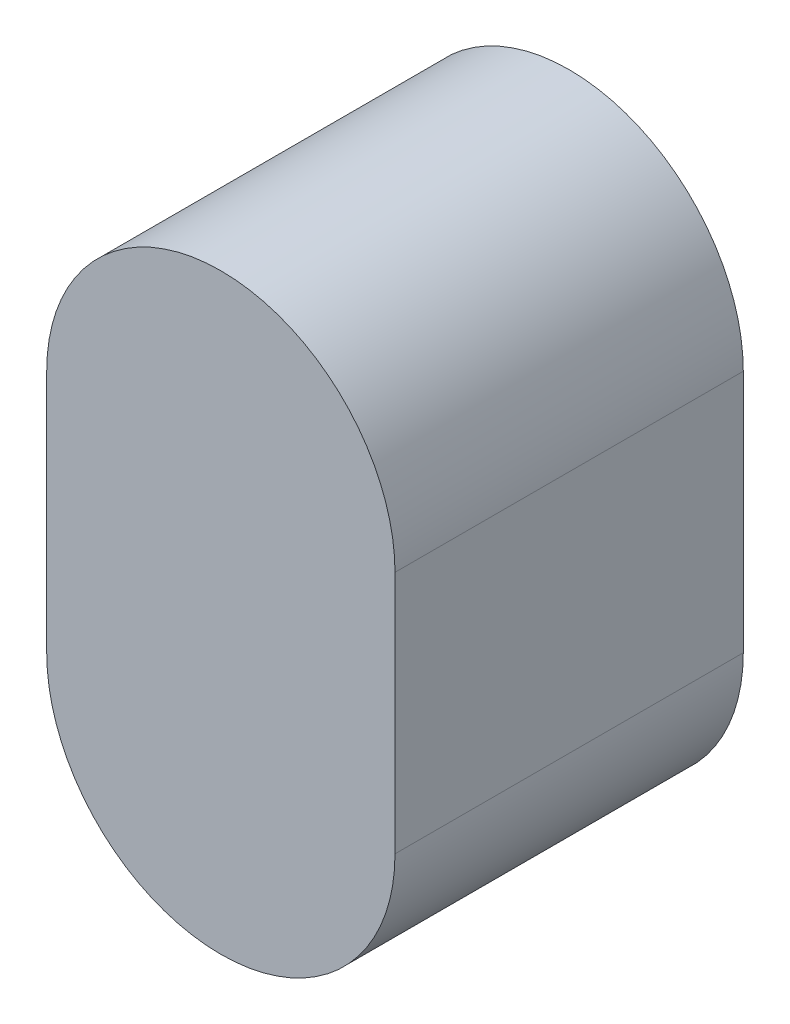
from build123d import *

# Parameters (mm, degrees)
DODANIE_WYCI_GNI_CIE1_DEPTH = 5


with BuildPart() as part:
    # Szkic1 → Dodanie-wyciągnięcie1 (new body)
    with BuildSketch(Plane.XY):
        with BuildLine():
            Line((-2.5, 0), (-2.5, 3.5))
            ThreePointArc((-2.5, 3.5), (0, 6), (2.5, 3.5))
            Line((2.5, 3.5), (2.5, 0))
            ThreePointArc((2.5, 0), (0, -2.5), (-2.5, 0))
        make_face()
    extrude(amount=DODANIE_WYCI_GNI_CIE1_DEPTH)


solid = part.part
